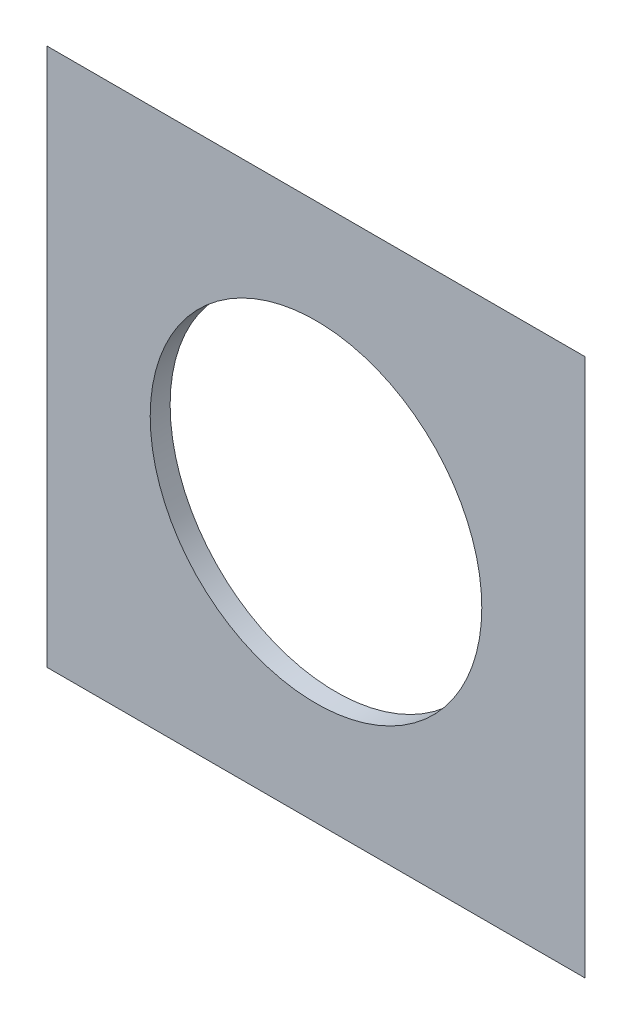
from build123d import *

# Parameters (mm, degrees)
SKETCH1_W           = 342.9
SKETCH1_H           = 342.9
BOSS_EXTRUDE1_DEPTH = 12.7
DRAFT1_ANGLE        = -45
SKETCH2_R           = 105.653774547
CUT_EXTRUDE1_DEPTH  = 243.799289538
CUT_EXTRUDE2_DEPTH  = 5.08


with BuildPart() as part:
    # Sketch1 → Boss-Extrude1 (new body)
    with BuildSketch(Plane.XY):
        Rectangle(SKETCH1_W, SKETCH1_H)
    extrude(amount=-BOSS_EXTRUDE1_DEPTH)

    # Draft1
    draft1_faces = [part.faces().sort_by_distance(p)[0] for p in [
        (-171.45, 0, -6.35),
        (0, -171.45, -6.35),
        (171.45, 0, -6.35),
        (0, 171.45, -6.35),
    ]]
    draft(draft1_faces, Plane.XY, DRAFT1_ANGLE)

    # Sketch2 → Cut-Extrude1 (cut, through all)
    with BuildSketch(Plane(origin=(0, 0, -12.7), x_dir=(-1, 0, 0), z_dir=(0, 0, -1))):
        Circle(SKETCH2_R)
    extrude(amount=-CUT_EXTRUDE1_DEPTH, mode=Mode.SUBTRACT)

    # Sketch3 → Cut-Extrude2 (cut)
    with BuildSketch(Plane(origin=(0, 0, -12.7), x_dir=(-1, 0, 0), z_dir=(0, 0, -1))):
        with BuildLine():
            Line((18.632943137, -145.166928512), (145.166928512, -18.632943137))
            ThreePointArc((145.166928512, -18.632943137), (154.686, -18.632943137), (154.686, -28.152014625))
            Line((154.686, -28.152014625), (28.152014625, -154.686))
            ThreePointArc((28.152014625, -154.686), (18.632943137, -154.686), (18.632943137, -145.166928512))
        make_face()
        with BuildLine():
            Line((-154.686, 28.152014625), (-28.152014625, 154.686))
            ThreePointArc((-28.152014625, 154.686), (-18.632943137, 154.686), (-18.632943137, 145.166928512))
            Line((-18.632943137, 145.166928512), (-145.166928512, 18.632943137))
            ThreePointArc((-145.166928512, 18.632943137), (-154.686, 18.632943137), (-154.686, 28.152014625))
        make_face()
    extrude(amount=-CUT_EXTRUDE2_DEPTH, mode=Mode.SUBTRACT)


solid = part.part
